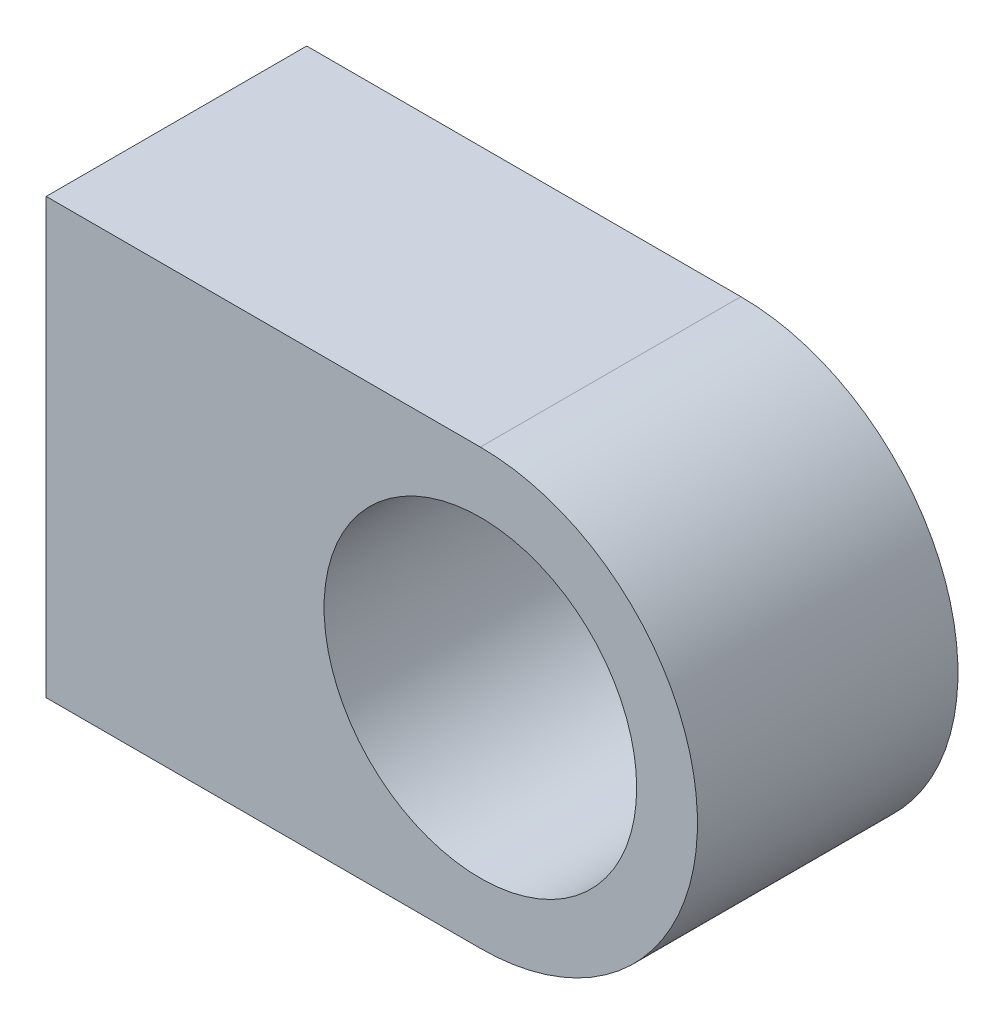
from build123d import *

# Parameters (mm, degrees)
SKETCH_2_R      = 1.8
EXTRUDE_1_DEPTH = 3


with BuildPart() as part:
    # 草图2 → 凸台-拉伸1 (new body)
    with BuildSketch(Plane.XY):
        with BuildLine():
            Line((0, 0), (-5, 0))
            Line((-5, 0), (-5, -5))
            Line((-5, -5), (0, -5))
            ThreePointArc((0, -5), (2.5, -2.5), (0, 0))
        make_face()
        with Locations((0, -2.5)):
            Circle(SKETCH_2_R, mode=Mode.SUBTRACT)
    extrude(amount=EXTRUDE_1_DEPTH)


solid = part.part
